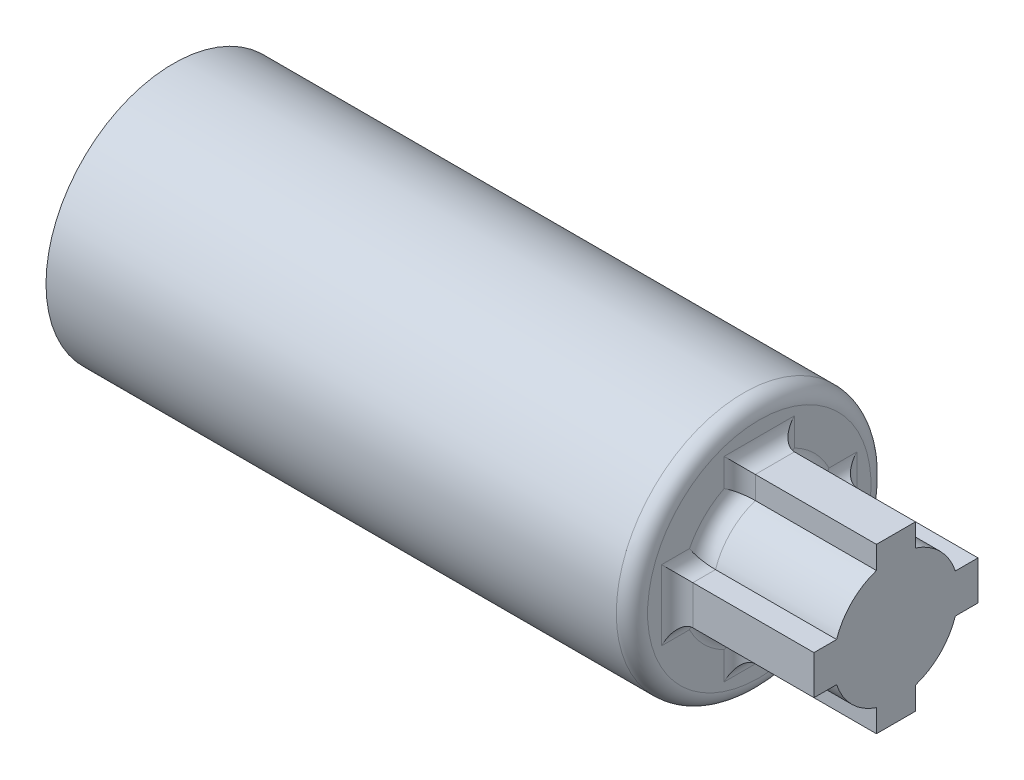
from build123d import *

# Parameters (mm, degrees)
BOSS_EXTRUDE1_DEPTH = 3.5
SKETCH1_3_R         = 3.259306638
BOSS_EXTRUDE2_DEPTH = 1
SKETCH1_4_R         = 3.259306638
BOSS_EXTRUDE3_DEPTH = 15
FILLET1_R           = 0.4


with BuildPart() as part:
    # Sketch1 → Boss-Extrude1 (new body)
    with BuildSketch(Plane.ZY.offset(-9.072873839)):
        with BuildLine():
            Line((-22.564889637, -14.994040891), (-21.564889637, -14.994040891))
            Line((-21.564889637, -14.994040891), (-21.564889637, -15.574172475))
            ThreePointArc((-21.564889637, -15.574172475), (-20.933518787, -15.962670041), (-20.545021222, -16.594040891))
            Line((-20.545021222, -16.594040891), (-19.964889637, -16.594040891))
            Line((-19.964889637, -16.594040891), (-19.964889637, -17.594040891))
            Line((-19.964889637, -17.594040891), (-20.545021222, -17.594040891))
            ThreePointArc((-20.545021222, -17.594040891), (-20.933518787, -18.225411741), (-21.564889637, -18.613909306))
            Line((-21.564889637, -18.613909306), (-21.564889637, -19.194040891))
            Line((-21.564889637, -19.194040891), (-22.564889637, -19.194040891))
            Line((-22.564889637, -19.194040891), (-22.564889637, -18.613909306))
            ThreePointArc((-22.564889637, -18.613909306), (-23.196260487, -18.225411741), (-23.584758053, -17.594040891))
            Line((-23.584758053, -17.594040891), (-24.164889637, -17.594040891))
            Line((-24.164889637, -17.594040891), (-24.164889637, -16.594040891))
            Line((-24.164889637, -16.594040891), (-23.584758053, -16.594040891))
            ThreePointArc((-23.584758053, -16.594040891), (-23.196260487, -15.962670041), (-22.564889637, -15.574172475))
            Line((-22.564889637, -15.574172475), (-22.564889637, -14.994040891))
        make_face()
    extrude(amount=-BOSS_EXTRUDE1_DEPTH)

    # Sketch1<3> → Boss-Extrude2 (add)
    with BuildSketch(Plane.ZY.offset(-9.072873839)):
        with Locations((-22.064889637, -17.094040891)):
            Circle(SKETCH1_3_R)
    extrude(amount=BOSS_EXTRUDE2_DEPTH)

    # Sketch1<4> → Boss-Extrude3 (add)
    with BuildSketch(Plane.ZY.offset(-9.072873839)):
        with Locations((-22.064889637, -17.094040891)):
            Circle(SKETCH1_4_R)
        with BuildLine():
            ThreePointArc((-23.752066801, -19.072280821), (-21.868548232, -14.501464942), (-20.694879361, -19.303808263))
            Line((-20.694879361, -19.303808263), (-23.752066801, -19.072280821))
        make_face(mode=Mode.SUBTRACT)
    extrude(amount=BOSS_EXTRUDE3_DEPTH)

    # Fillet1
    fillet1_edges = [part.edges().sort_by_distance(p)[0] for p in [
        (9.072873839, -17.094040891, -25.324196275),
        (9.072873839, -18.225411741, -23.196260487),
        (9.072873839, -17.594040891, -23.874823845),
        (9.072873839, -17.094040891, -24.164889637),
        (9.072873839, -16.594040891, -23.874823845),
        (9.072873839, -15.962670041, -23.196260487),
        (9.072873839, -15.284106683, -22.564889637),
        (9.072873839, -14.994040891, -22.064889637),
        (9.072873839, -15.284106683, -21.564889637),
        (9.072873839, -15.962670041, -20.933518787),
        (9.072873839, -16.594040891, -20.25495543),
        (9.072873839, -17.094040891, -19.964889637),
        (9.072873839, -17.594040891, -20.25495543),
        (9.072873839, -18.225411741, -20.933518787),
        (9.072873839, -18.903975098, -21.564889637),
        (9.072873839, -19.194040891, -22.064889637),
        (9.072873839, -18.903975098, -22.564889637),
    ]]
    fillet(fillet1_edges, radius=FILLET1_R)


solid = part.part
